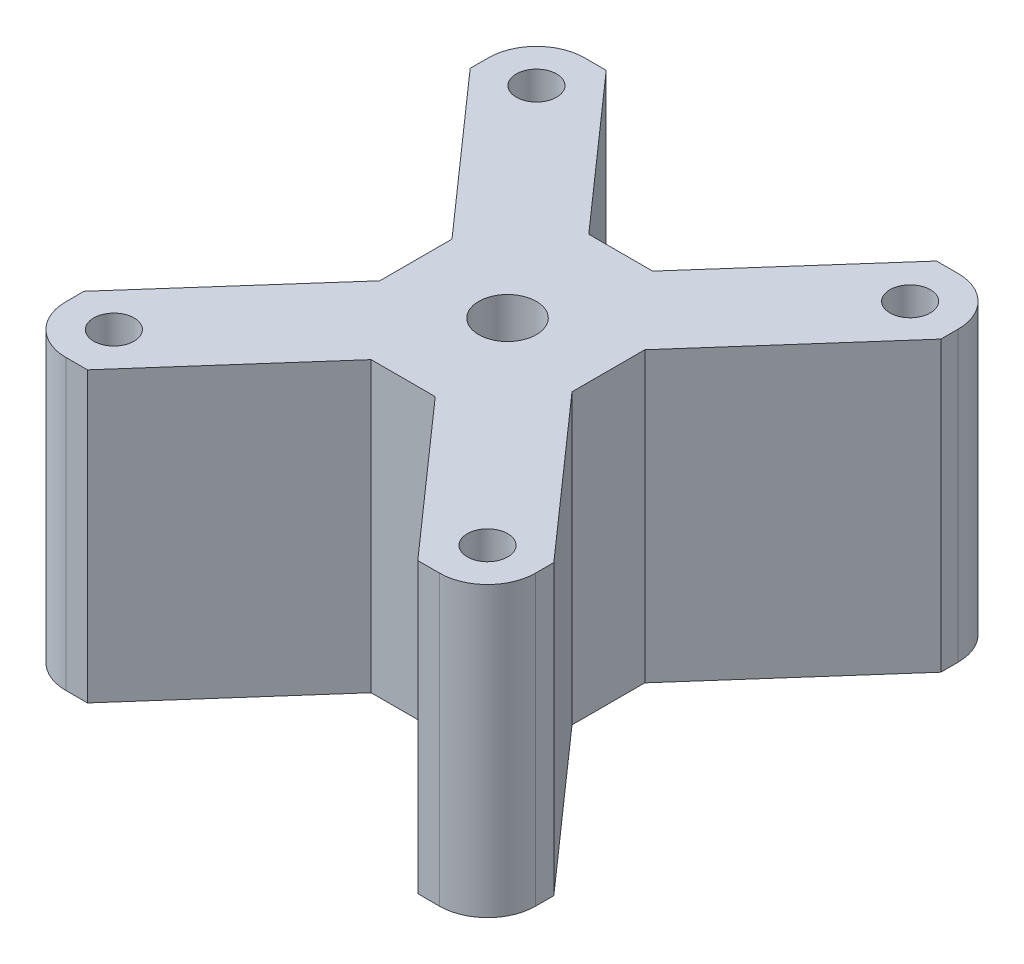
from build123d import *

# Parameters (mm, degrees)
SKETCH_1_R      = 1.05
SKETCH_1_R_2    = 1.5
EXTRUDE_3_DEPTH = 15


with BuildPart() as part:
    # 草图1 → 凸台-拉伸3 (new body)
    with BuildSketch(Plane(origin=(0, 0, 0), x_dir=(1, 0, 0), z_dir=(0, 1, 0))):
        with BuildLine():
            Line((-4.997530566, 2.110812699), (-12.214, 10.272242924))
            Line((-12.214, 10.272242924), (-12.214, 11.219))
            ThreePointArc((-12.214, 11.219), (-11.481766953, 12.986766953), (-9.714, 13.719))
            Line((-9.714, 13.719), (-8.587402673, 13.719))
            Line((-8.587402673, 13.719), (-1.66039255, 5.884932345))
            Line((-1.66039255, 5.884932345), (1.66039255, 5.884932345))
            Line((1.66039255, 5.884932345), (8.587402672, 13.719))
            Line((8.587402672, 13.719), (9.714, 13.719))
            ThreePointArc((9.714, 13.719), (11.481766953, 12.986766953), (12.214, 11.219))
            Line((12.214, 11.219), (12.214, 10.317530105))
            Line((12.214, 10.317530105), (4.997530566, 2.139803462))
            Line((4.997530566, 2.139803462), (4.997530566, -1.644812699))
            Line((4.997530566, -1.644812699), (12.214, -9.806242924))
            Line((12.214, -9.806242924), (12.214, -10.753))
            ThreePointArc((12.214, -10.753), (11.481766953, -12.520766953), (9.714, -13.253))
            Line((9.714, -13.253), (8.587402673, -13.253))
            Line((8.587402673, -13.253), (1.66039255, -5.418932345))
            Line((1.66039255, -5.418932345), (-1.672707789, -5.418932345))
            Line((-1.672707789, -5.418932345), (-8.585913897, -13.253))
            Line((-8.585913897, -13.253), (-9.714, -13.253))
            ThreePointArc((-9.714, -13.253), (-11.481766953, -12.520766953), (-12.214, -10.753))
            Line((-12.214, -10.753), (-12.214, -9.806242924))
            Line((-12.214, -9.806242924), (-4.997530566, -1.644812699))
            Line((-4.997530566, -1.644812699), (-4.997530566, 2.110812699))
        make_face()
        with Locations(Location((-9.714, 11.219, 0), (0, 0, 270))):
            Circle(SKETCH_1_R, mode=Mode.SUBTRACT)
        with Locations(Location((9.714, 11.219, 0), (0, 0, 270))):
            Circle(SKETCH_1_R, mode=Mode.SUBTRACT)
        with Locations(Location((-9.714, -10.753, 0), (0, 0, 270))):
            Circle(SKETCH_1_R, mode=Mode.SUBTRACT)
        with Locations(Location((9.714, -10.753, 0), (0, 0, 270))):
            Circle(SKETCH_1_R, mode=Mode.SUBTRACT)
        with Locations(Location((0, 0, 0), (0, 0, 270))):
            Circle(SKETCH_1_R_2, mode=Mode.SUBTRACT)
    extrude(amount=EXTRUDE_3_DEPTH)


solid = part.part
